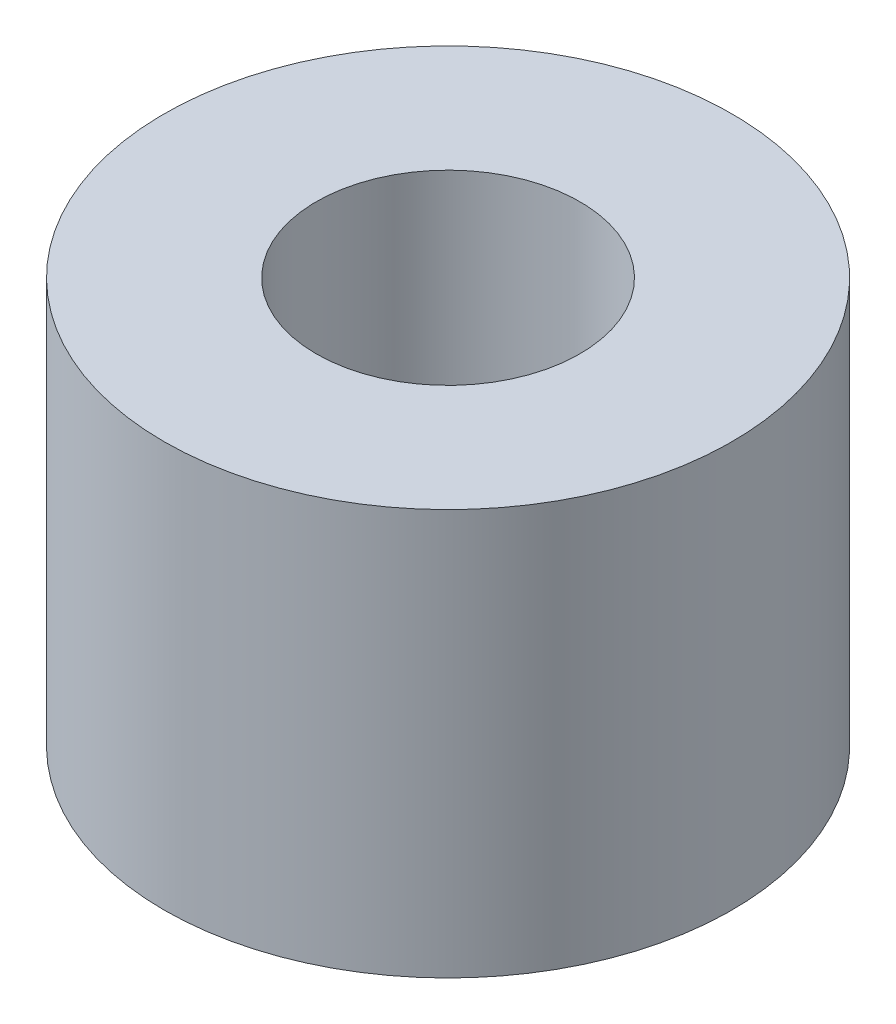
from build123d import *

# Parameters (mm, degrees)
SKETCH1_R           = 5.6
SKETCH1_R_2         = 2.6
BOSS_EXTRUDE1_DEPTH = 8


with BuildPart() as part:
    # Sketch1 → Boss-Extrude1 (new body)
    with BuildSketch(Plane(origin=(0, 0, 0), x_dir=(1, 0, 0), z_dir=(0, 1, 0))):
        with Locations(Location((0, 0, 0), (0, 0, 270))):
            Circle(SKETCH1_R)
        with Locations(Location((0, 0, 0), (0, 0, 270))):
            Circle(SKETCH1_R_2, mode=Mode.SUBTRACT)
    extrude(amount=BOSS_EXTRUDE1_DEPTH)


solid = part.part
